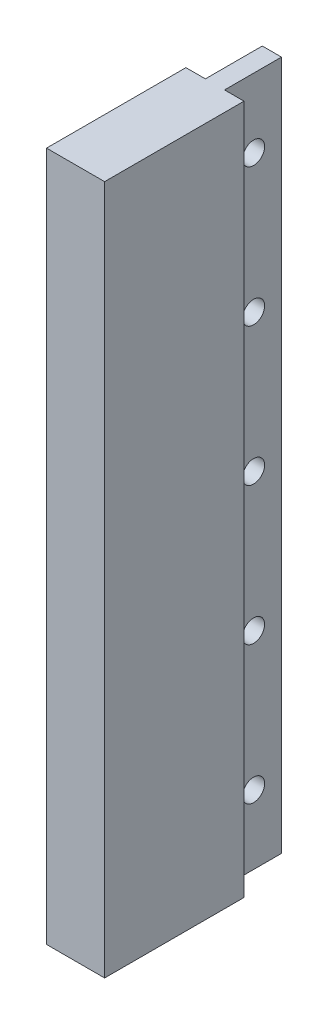
from build123d import *

# Parameters (mm, degrees)
SKETCH1_W           = 118.75
SKETCH1_H           = 24
BOSS_EXTRUDE1_DEPTH = 10
SKETCH2_W           = 3.3
SKETCH2_H           = 9.8
BOSS_EXTRUDE2_DEPTH = 118.75
CUT_EXTRUDE1_REACH  = 123.333
SKETCH4_R           = 1.9
LPATTERN1_COUNT     = 5
LPATTERN1_PITCH     = 23.75


with BuildPart() as part:
    # Sketch1 → Boss-Extrude1 (new body)
    with BuildSketch(Plane.YZ):
        with Locations((59.375, 12)):
            Rectangle(SKETCH1_W, SKETCH1_H)
    extrude(amount=-BOSS_EXTRUDE1_DEPTH)

    # Sketch2 → Boss-Extrude2 (add, through all)
    with BuildSketch(Plane.XZ):
        with Locations((-5, -4.9)):
            Rectangle(SKETCH2_W, SKETCH2_H)
    extrude(amount=-BOSS_EXTRUDE2_DEPTH)

    # Sketch4 → Cut-Extrude1 (cut, up to next)
    with BuildSketch(Plane(origin=(-6.65, 0, 0), x_dir=(0, -1, 0), z_dir=(-1, 0, 0)), mode=Mode.PRIVATE) as cut_extrude1_sk1:
        with Locations(Location((-106.875, -5, 0), (0, 0, 90))):
            Circle(SKETCH4_R)
    cut_extrude1_tool1 = extrude(cut_extrude1_sk1.sketch, amount=-CUT_EXTRUDE1_REACH, mode=Mode.PRIVATE) & part.part
    cut_extrude1 = cut_extrude1_tool1.solids().sort_by_distance((-6.65, 106.875, -5))[0]
    add(cut_extrude1, mode=Mode.SUBTRACT)

    # LPattern1: Cut-Extrude1 ×5
    with Locations(*[(0, -i * LPATTERN1_PITCH, 0) for i in range(1, LPATTERN1_COUNT)]):
        add(cut_extrude1, mode=Mode.SUBTRACT)


solid = part.part
